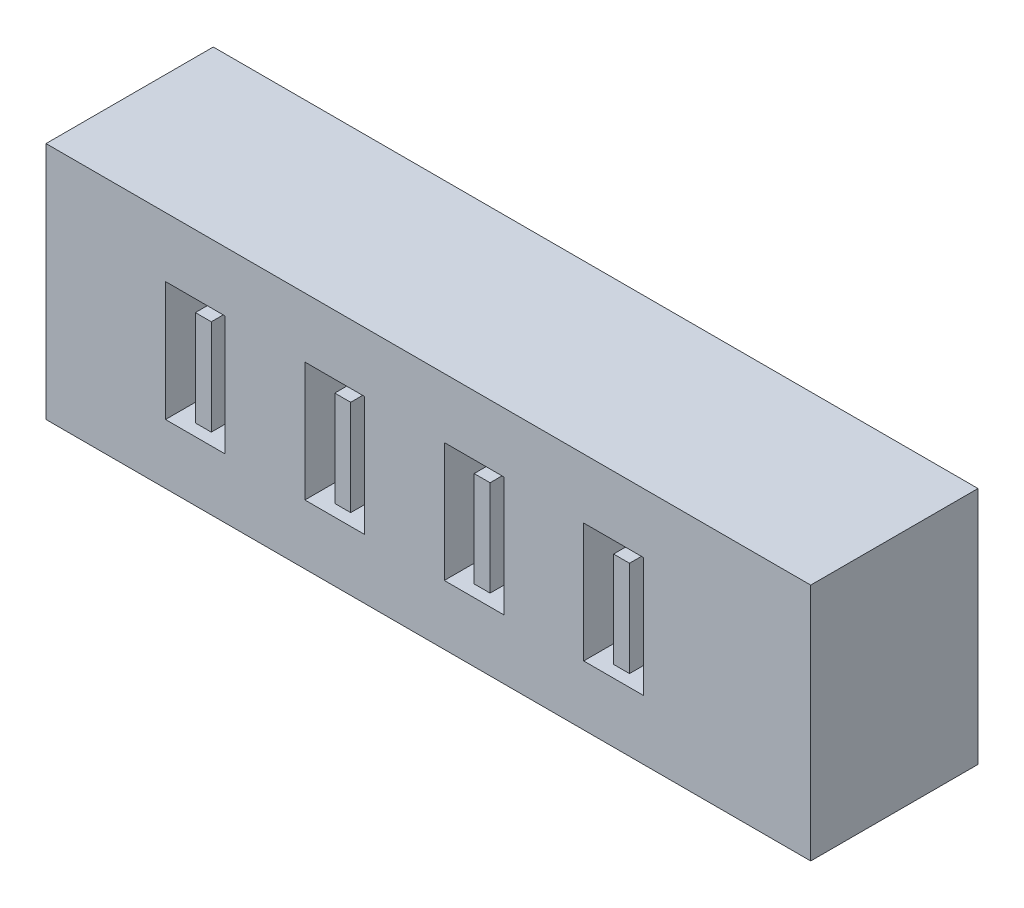
from build123d import *

# Parameters (mm, degrees)
ESQUISSE1_W                = 96
ESQUISSE1_H                = 30
BOSS_EXTRU_1_DEPTH         = 21
ESQUISSE2_W                = 7.5
ESQUISSE2_H                = 15
ESQUISSE2_W_2              = 2
ESQUISSE2_H_2              = 12
ENL_V_MAT_EXTRU_1_DEPTH    = 12
R_P_TITION_LIN_AIRE1_COUNT = 4
R_P_TITION_LIN_AIRE1_PITCH = 17.5


with BuildPart() as part:
    # Esquisse1 → Boss.-Extru.1 (new body)
    with BuildSketch(Plane.XY):
        with Locations((14.064055763, -0.233160622)):
            Rectangle(ESQUISSE1_W, ESQUISSE1_H)
    extrude(amount=BOSS_EXTRU_1_DEPTH)

    # Esquisse2 → Enlèv. mat.-Extru.1 (cut)
    with BuildSketch(Plane.XY.offset(21)):
        with Locations((-15.185944237, -0.233160622)):
            Rectangle(ESQUISSE2_W, ESQUISSE2_H)
        with Locations((-14.185944237, -0.233160622)):
            Rectangle(ESQUISSE2_W_2, ESQUISSE2_H_2, mode=Mode.SUBTRACT)
    enl_v_mat_extru_1 = extrude(amount=-ENL_V_MAT_EXTRU_1_DEPTH, mode=Mode.SUBTRACT)

    # Répétition linéaire1: Enlèv. mat.-Extru.1 ×4
    with Locations(*[(i * R_P_TITION_LIN_AIRE1_PITCH, 0, 0) for i in range(1, R_P_TITION_LIN_AIRE1_COUNT)]):
        add(enl_v_mat_extru_1, mode=Mode.SUBTRACT)


solid = part.part
